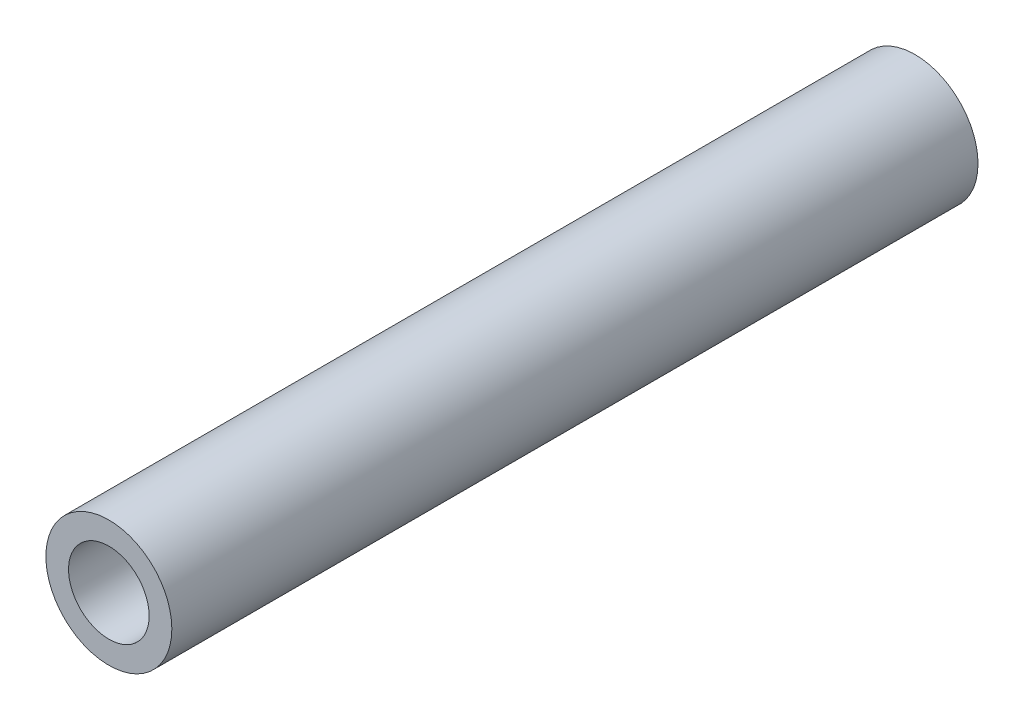
from build123d import *

# Parameters (mm, degrees)
SKETCH1_R           = 3.96875
SKETCH1_R_2         = 2.54
BOSS_EXTRUDE1_DEPTH = 50.8


with BuildPart() as part:
    # Sketch1 → Boss-Extrude1 (new body)
    with BuildSketch(Plane.XY):
        Circle(SKETCH1_R)
        Circle(SKETCH1_R_2, mode=Mode.SUBTRACT)
    extrude(amount=BOSS_EXTRUDE1_DEPTH)


solid = part.part
